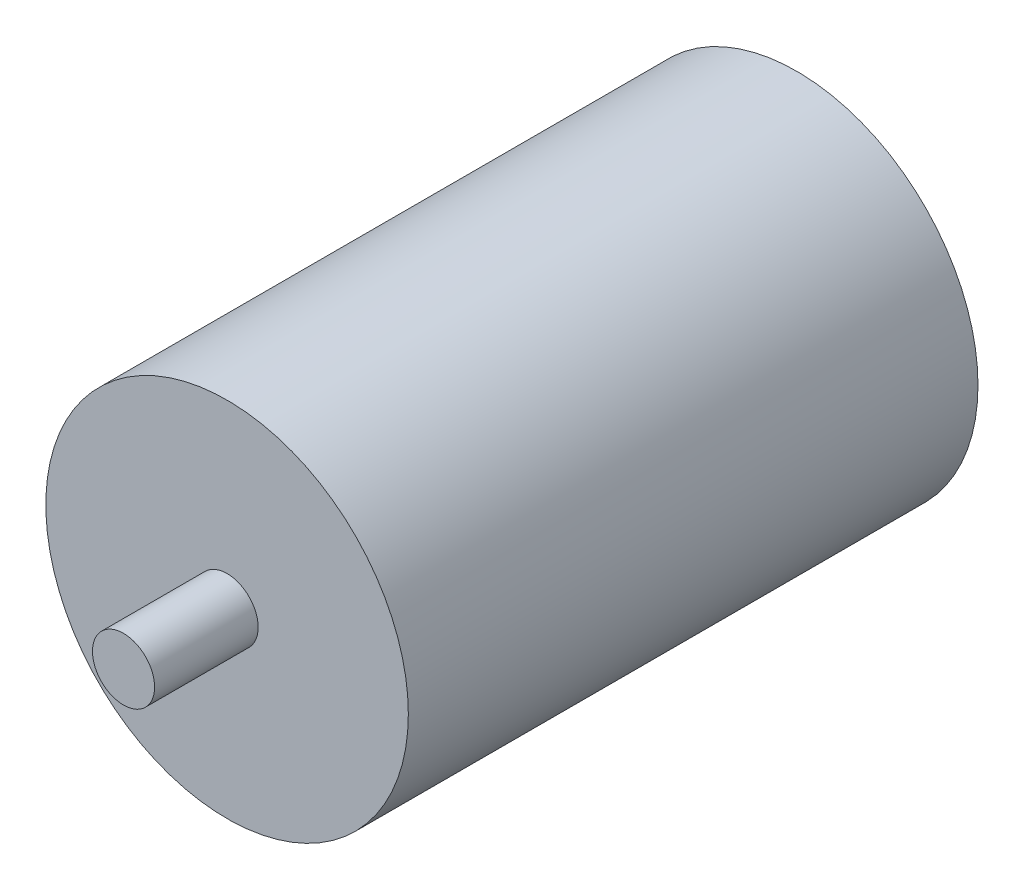
from build123d import *

# Parameters (mm, degrees)
SKETCH1_R           = 44.45
SKETCH1_R_2         = 38.1
BOSS_EXTRUDE1_DEPTH = 127
SKETCH2_R           = 44.45
BOSS_EXTRUDE2_DEPTH = 12.7
SKETCH3_R           = 7.62
BOSS_EXTRUDE3_DEPTH = 25.4


with BuildPart() as part:
    # Sketch1 → Boss-Extrude1 (new body)
    with BuildSketch(Plane.XY):
        Circle(SKETCH1_R)
        Circle(SKETCH1_R_2, mode=Mode.SUBTRACT)
    extrude(amount=BOSS_EXTRUDE1_DEPTH)

    # Sketch2 → Boss-Extrude2 (add)
    with BuildSketch(Plane.XY.offset(127)):
        Circle(SKETCH2_R)
    extrude(amount=BOSS_EXTRUDE2_DEPTH)

    # Sketch3 → Boss-Extrude3 (add)
    with BuildSketch(Plane.XY.offset(139.7)):
        Circle(SKETCH3_R)
    extrude(amount=BOSS_EXTRUDE3_DEPTH)


solid = part.part
